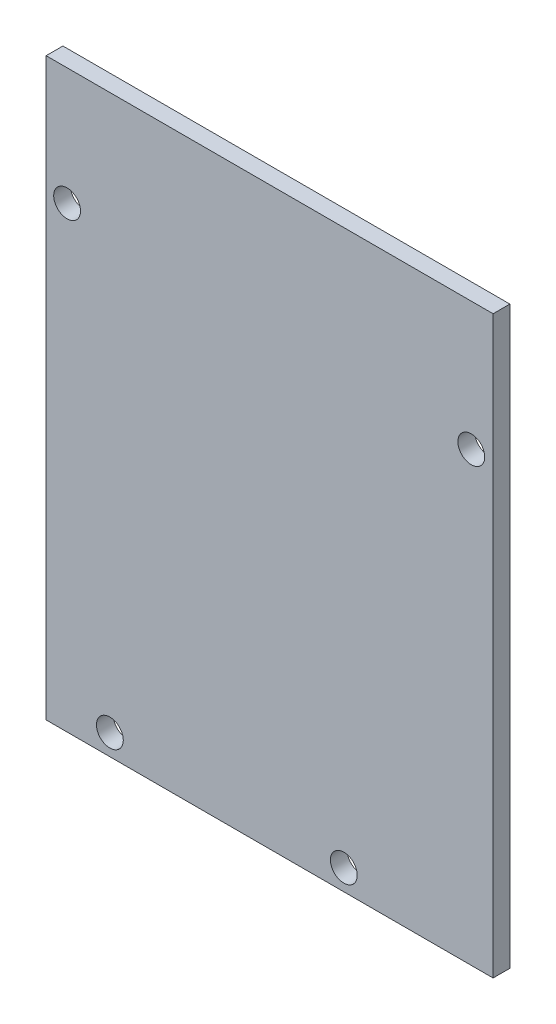
from build123d import *

# Parameters (mm, degrees)
SKETCH1_W           = 53.3
SKETCH1_H           = 68.6
SKETCH1_R           = 1.6
BOSS_EXTRUDE1_DEPTH = 2


with BuildPart() as part:
    # Sketch1 → Boss-Extrude1 (new body)
    with BuildSketch(Plane.XY):
        Rectangle(SKETCH1_W, SKETCH1_H)
        with Locations((-19.05, -31.8)):
            Circle(SKETCH1_R, mode=Mode.SUBTRACT)
        with Locations((-24.15, 20.3)):
            Circle(SKETCH1_R, mode=Mode.SUBTRACT)
        with Locations((24.05, 19)):
            Circle(SKETCH1_R, mode=Mode.SUBTRACT)
        with Locations((8.85, -31.8)):
            Circle(SKETCH1_R, mode=Mode.SUBTRACT)
    extrude(amount=BOSS_EXTRUDE1_DEPTH)


solid = part.part
